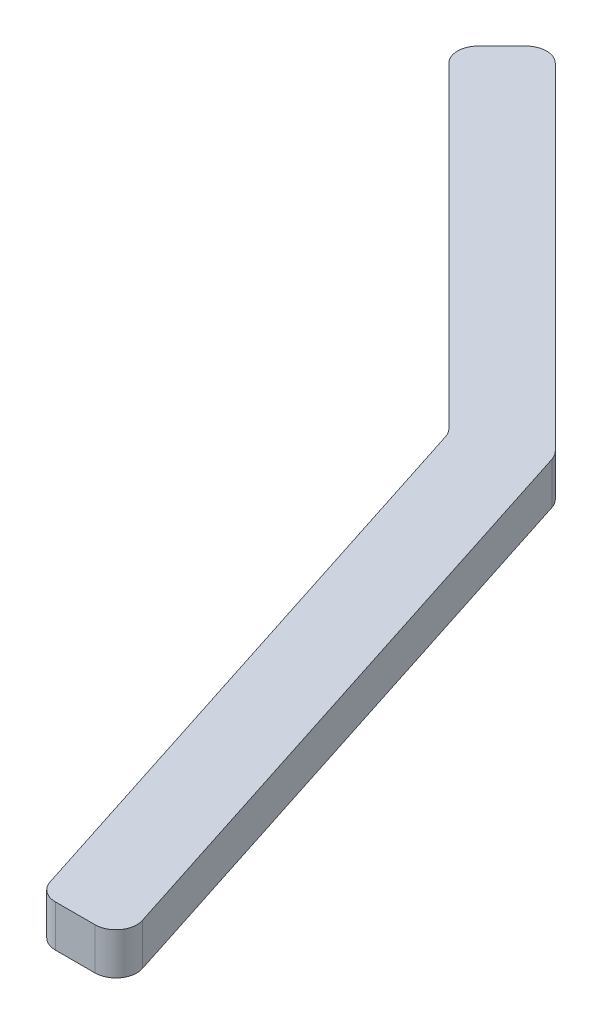
from build123d import *

# Parameters (mm, degrees)
BOSS_EXTRUDE1_DEPTH = 12.7


with BuildPart() as part:
    # Sketch1 → Boss-Extrude1 (new body)
    with BuildSketch(Plane(origin=(0, 0, 0), x_dir=(1, 0, 0), z_dir=(0, 1, 0))):
        with BuildLine():
            Line((-2.671745921, 8.296474175), (-60.783183135, 188.74777921))
            Line((-60.783183135, 188.74777921), (-61.817176572, 191.958600936))
            ThreePointArc((-61.817176572, 191.958600936), (-62.442896831, 193.322917601), (-63.371363054, 194.502254821))
            Line((-63.371363054, 194.502254821), (-65.756579877, 196.887471644))
            Line((-65.756579877, 196.887471644), (-165.560118982, 296.691010749))
            ThreePointArc((-165.560118982, 296.691010749), (-170.050247042, 298.550882688), (-174.540375103, 296.691010749))
            Line((-174.540375103, 296.691010749), (-181.72458, 289.506805852))
            ThreePointArc((-181.72458, 289.506805852), (-183.584451939, 285.016677791), (-181.72458, 280.526549731))
            Line((-181.72458, 280.526549731), (-85.480125087, 184.282094819))
            ThreePointArc((-85.480125087, 184.282094819), (-84.551658864, 183.102757598), (-83.925938605, 181.738440933))
            Line((-83.925938605, 181.738440933), (-26.818084588, 4.403525825))
            ThreePointArc((-26.818084588, 4.403525825), (-24.512913596, 1.217621847), (-20.773770045, 0))
            Line((-20.773770045, 0), (-8.716060463, 0))
            ThreePointArc((-8.716060463, 0), (-3.58368231, 2.610856449), (-2.671745921, 8.296474175))
        make_face()
    extrude(amount=BOSS_EXTRUDE1_DEPTH)


solid = part.part
